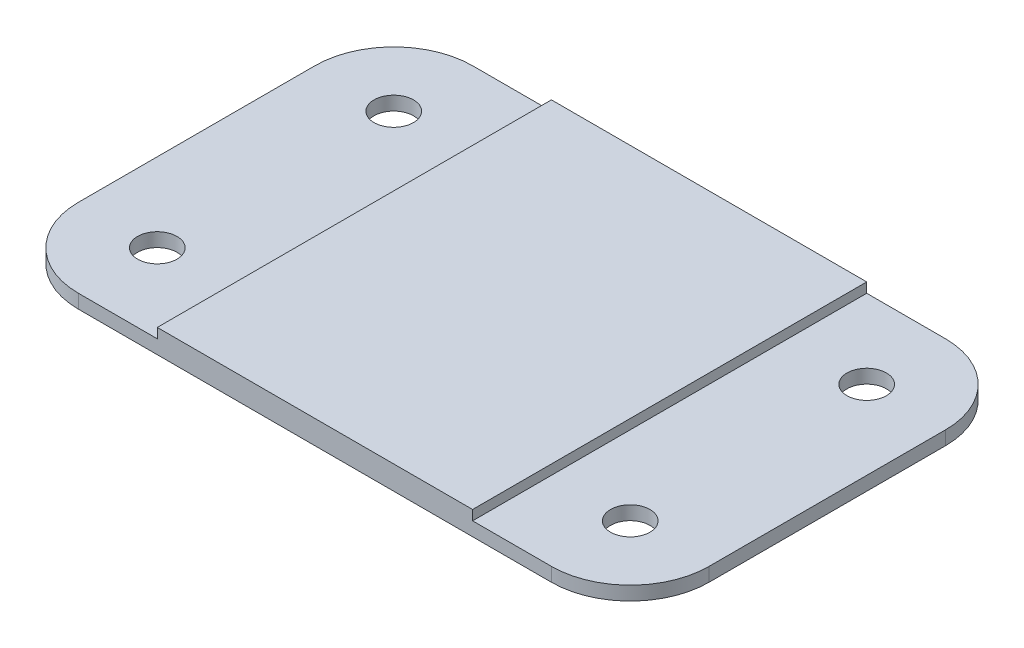
from build123d import *

# Parameters (mm, degrees)
SKETCH1_R           = 6.35
BOSS_EXTRUDE2_DEPTH = 7.62
CUT_EXTRUDE2_START  = -3.175
SKETCH3_R           = 6.35
CUT_EXTRUDE2_DEPTH  = 3.175
SKETCH4_W           = 25.4
SKETCH4_H           = 25.4
BOSS_EXTRUDE3_DEPTH = 50.8


with BuildPart() as part:
    # Sketch1 → Boss-Extrude2 (new body)
    with BuildSketch(Plane(origin=(0, 0, 0), x_dir=(1, 0, 0), z_dir=(0, 1, 0))):
        with BuildLine():
            Line((-76.2, 63.5), (76.2, 63.5))
            ThreePointArc((76.2, 63.5), (94.160512242, 56.060512242), (101.6, 38.1))
            Line((101.6, 38.1), (101.6, -38.1))
            ThreePointArc((101.6, -38.1), (94.160512242, -56.060512242), (76.2, -63.5))
            Line((76.2, -63.5), (-76.2, -63.5))
            ThreePointArc((-76.2, -63.5), (-94.160512242, -56.060512242), (-101.6, -38.1))
            Line((-101.6, -38.1), (-101.6, 38.1))
            ThreePointArc((-101.6, 38.1), (-94.160512242, 56.060512242), (-76.2, 63.5))
        make_face()
        with Locations(Location((-76.2, 38.1, 0), (0, 0, 90))):
            Circle(SKETCH1_R, mode=Mode.SUBTRACT)
        with Locations(Location((76.2, -38.1, 0), (0, 0, 90))):
            Circle(SKETCH1_R, mode=Mode.SUBTRACT)
        with Locations(Location((76.2, 38.1, 0), (0, 0, 90))):
            Circle(SKETCH1_R, mode=Mode.SUBTRACT)
        with Locations(Location((-76.2, -38.1, 0), (0, 0, 90))):
            Circle(SKETCH1_R, mode=Mode.SUBTRACT)
    extrude(amount=BOSS_EXTRUDE2_DEPTH)

    # Sketch3 → Cut-Extrude2 (cut)
    # profile 1 of 2: a face of its own
    with BuildSketch(Plane(origin=(0, 7.62, 0), x_dir=(1, 0, 0), z_dir=(0, 1, 0)).offset(CUT_EXTRUDE2_START)):
        with BuildLine():
            Line((-50.8, -63.5), (-50.8, 63.5))
            Line((-50.8, 63.5), (-76.2, 63.5))
            ThreePointArc((-76.2, 63.5), (-94.160512242, 56.060512242), (-101.6, 38.1))
            Line((-101.6, 38.1), (-101.6, -38.1))
            ThreePointArc((-101.6, -38.1), (-94.160512242, -56.060512242), (-76.2, -63.5))
            Line((-76.2, -63.5), (-50.8, -63.5))
        make_face()
        with Locations(Location((-76.2, -38.1, 0), (0, 0, 90))):
            Circle(SKETCH3_R, mode=Mode.SUBTRACT)
        with Locations(Location((-76.2, 38.1, 0), (0, 0, 90))):
            Circle(SKETCH3_R, mode=Mode.SUBTRACT)
    # profile 2 of 2: a face of its own
    with BuildSketch(Plane(origin=(0, 7.62, 0), x_dir=(1, 0, 0), z_dir=(0, 1, 0)).offset(CUT_EXTRUDE2_START)):
        with BuildLine():
            Line((76.2, 63.5), (50.8, 63.5))
            Line((50.8, 63.5), (50.8, -63.5))
            Line((50.8, -63.5), (76.2, -63.5))
            ThreePointArc((76.2, -63.5), (94.160512242, -56.060512242), (101.6, -38.1))
            Line((101.6, -38.1), (101.6, 38.1))
            ThreePointArc((101.6, 38.1), (94.160512242, 56.060512242), (76.2, 63.5))
        make_face()
        with Locations(Location((76.2, -38.1, 0), (0, 0, 90))):
            Circle(SKETCH3_R, mode=Mode.SUBTRACT)
        with Locations(Location((76.2, 38.1, 0), (0, 0, 90))):
            Circle(SKETCH3_R, mode=Mode.SUBTRACT)
    extrude(amount=CUT_EXTRUDE2_DEPTH, mode=Mode.SUBTRACT)

    # Sketch4 → Boss-Extrude3 (add)
    with BuildSketch(Plane.XZ):
        Rectangle(SKETCH4_W, SKETCH4_H)
    extrude(amount=BOSS_EXTRUDE3_DEPTH)


solid = part.part
